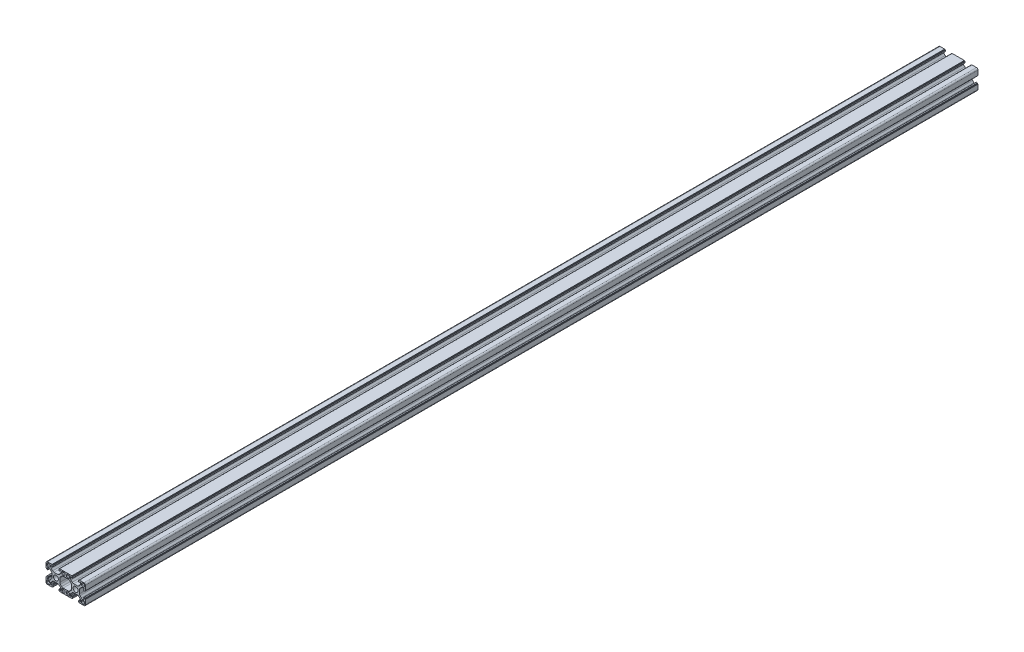
from build123d import *

# Parameters (mm, degrees)
EXTRUDE_1_DEPTH = 905


with BuildPart() as part:
    # Эскиз1 → Бобышка-Вытянуть1 (new body)
    with BuildSketch(Plane.XY):
        with BuildLine():
            Line((-0.885103948, 23.190978906), (1.013676721, 23.190978906))
            ThreePointArc((1.013676721, 23.190978906), (1.779043586, 23.343219841), (2.427890283, 23.776765343))
            Line((2.427890283, 23.776765343), (3.729109614, 25.077984674))
            ThreePointArc((3.729109614, 25.077984674), (4.162655117, 25.726831372), (4.314896052, 26.492198236))
            Line((4.314896052, 26.492198236), (4.314896052, 27.390978906))
            ThreePointArc((4.314896052, 27.390978906), (4.168449443, 27.744532296), (3.814896052, 27.890978906))
            Line((3.814896052, 27.890978906), (3.712002833, 27.890978906))
            ThreePointArc((3.712002833, 27.890978906), (3.520661117, 27.852918672), (3.358449443, 27.744532296))
            Line((3.358449443, 27.744532296), (2.878119357, 27.26420221))
            ThreePointArc((2.878119357, 27.26420221), (2.797013519, 27.210009022), (2.701342661, 27.190978906))
            Line((2.701342661, 27.190978906), (2.414896052, 27.190978906))
            ThreePointArc((2.414896052, 27.190978906), (2.238119357, 27.26420221), (2.164896052, 27.440978906))
            Line((2.164896052, 27.440978906), (2.164896052, 28.590049726))
            ThreePointArc((2.164896052, 28.590049726), (2.208830035, 28.696115743), (2.314896052, 28.740049726))
            Line((2.314896052, 28.740049726), (2.814896052, 28.740049726))
            Line((2.814896052, 28.740049726), (2.814896052, 29.040978906))
            ThreePointArc((2.814896052, 29.040978906), (2.858830035, 29.147044923), (2.964896052, 29.190978906))
            Line((2.964896052, 29.190978906), (7.614896052, 29.190978906))
            ThreePointArc((7.614896052, 29.190978906), (8.675556224, 28.751639077), (9.114896052, 27.690978906))
            Line((9.114896052, 27.690978906), (9.114896052, 23.040978906))
            ThreePointArc((9.114896052, 23.040978906), (9.070962069, 22.934912888), (8.964896052, 22.890978906))
            Line((8.964896052, 22.890978906), (8.663966872, 22.890978906))
            Line((8.663966872, 22.890978906), (8.663966872, 22.390978906))
            ThreePointArc((8.663966872, 22.390978906), (8.62003289, 22.284912888), (8.513966872, 22.240978906))
            Line((8.513966872, 22.240978906), (7.364896052, 22.240978906))
            ThreePointArc((7.364896052, 22.240978906), (7.188119357, 22.31420221), (7.114896052, 22.490978906))
            Line((7.114896052, 22.490978906), (7.114896052, 22.777425515))
            ThreePointArc((7.114896052, 22.777425515), (7.133926169, 22.873096373), (7.188119357, 22.95420221))
            Line((7.188119357, 22.95420221), (7.668449443, 23.434532296))
            ThreePointArc((7.668449443, 23.434532296), (7.776835818, 23.596743971), (7.814896052, 23.788085687))
            Line((7.814896052, 23.788085687), (7.814896052, 23.890978906))
            ThreePointArc((7.814896052, 23.890978906), (7.668449443, 24.244532296), (7.314896052, 24.390978906))
            Line((7.314896052, 24.390978906), (6.416115383, 24.390978906))
            ThreePointArc((6.416115383, 24.390978906), (5.650748518, 24.238737971), (5.001901821, 23.805192468))
            Line((5.001901821, 23.805192468), (3.70068249, 22.503973137))
            ThreePointArc((3.70068249, 22.503973137), (3.267136987, 21.855126439), (3.114896052, 21.089759575))
            Line((3.114896052, 21.089759575), (3.114896052, 19.190978906))
            Line((3.114896052, 19.190978906), (3.114896052, 17.292198236))
            ThreePointArc((3.114896052, 17.292198236), (3.267136987, 16.526831372), (3.70068249, 15.877984674))
            Line((3.70068249, 15.877984674), (5.001901821, 14.576765343))
            ThreePointArc((5.001901821, 14.576765343), (5.650748518, 14.143219841), (6.416115383, 13.990978906))
            Line((6.416115383, 13.990978906), (7.314896052, 13.990978906))
            ThreePointArc((7.314896052, 13.990978906), (7.668449443, 14.137425515), (7.814896052, 14.490978906))
            Line((7.814896052, 14.490978906), (7.814896052, 14.593872124))
            ThreePointArc((7.814896052, 14.593872124), (7.776835818, 14.785213841), (7.668449443, 14.947425515))
            Line((7.668449443, 14.947425515), (7.188119357, 15.427755601))
            ThreePointArc((7.188119357, 15.427755601), (7.133926169, 15.508861438), (7.114896052, 15.604532296))
            Line((7.114896052, 15.604532296), (7.114896052, 15.890978906))
            ThreePointArc((7.114896052, 15.890978906), (7.188119357, 16.067755601), (7.364896052, 16.140978906))
            Line((7.364896052, 16.140978906), (8.513966872, 16.140978906))
            ThreePointArc((8.513966872, 16.140978906), (8.62003289, 16.097044923), (8.663966872, 15.990978906))
            Line((8.663966872, 15.990978906), (8.663966872, 15.490978906))
            Line((8.663966872, 15.490978906), (8.964896052, 15.490978906))
            ThreePointArc((8.964896052, 15.490978906), (9.070962069, 15.447044923), (9.114896052, 15.340978906))
            Line((9.114896052, 15.340978906), (9.114896052, 10.690978906))
            ThreePointArc((9.114896052, 10.690978906), (8.675556224, 9.630318734), (7.614896052, 9.190978906))
            Line((7.614896052, 9.190978906), (2.964896052, 9.190978906))
            ThreePointArc((2.964896052, 9.190978906), (2.858830035, 9.234912888), (2.814896052, 9.340978906))
            Line((2.814896052, 9.340978906), (2.814896052, 9.641908085))
            Line((2.814896052, 9.641908085), (2.314896052, 9.641908085))
            ThreePointArc((2.314896052, 9.641908085), (2.208830035, 9.685842068), (2.164896052, 9.791908085))
            Line((2.164896052, 9.791908085), (2.164896052, 10.940978906))
            ThreePointArc((2.164896052, 10.940978906), (2.238119357, 11.117755601), (2.414896052, 11.190978906))
            Line((2.414896052, 11.190978906), (2.701342661, 11.190978906))
            ThreePointArc((2.701342661, 11.190978906), (2.797013519, 11.171948789), (2.878119357, 11.117755601))
            Line((2.878119357, 11.117755601), (3.358449443, 10.637425515))
            ThreePointArc((3.358449443, 10.637425515), (3.520661117, 10.529039139), (3.712002833, 10.490978906))
            Line((3.712002833, 10.490978906), (3.814896052, 10.490978906))
            ThreePointArc((3.814896052, 10.490978906), (4.168449443, 10.637425515), (4.314896052, 10.990978906))
            Line((4.314896052, 10.990978906), (4.314896052, 11.889759575))
            ThreePointArc((4.314896052, 11.889759575), (4.162655117, 12.655126439), (3.729109614, 13.303973137))
            Line((3.729109614, 13.303973137), (2.427890283, 14.605192468))
            ThreePointArc((2.427890283, 14.605192468), (1.779043586, 15.038737971), (1.013676721, 15.190978906))
            Line((1.013676721, 15.190978906), (-0.885103948, 15.190978906))
            Line((-0.885103948, 15.190978906), (-2.783884617, 15.190978906))
            ThreePointArc((-2.783884617, 15.190978906), (-3.549251482, 15.038737971), (-4.198098179, 14.605192468))
            Line((-4.198098179, 14.605192468), (-5.49931751, 13.303973137))
            ThreePointArc((-5.49931751, 13.303973137), (-5.932863013, 12.655126439), (-6.085103948, 11.889759575))
            Line((-6.085103948, 11.889759575), (-6.085103948, 10.990978906))
            ThreePointArc((-6.085103948, 10.990978906), (-5.938657339, 10.637425515), (-5.585103948, 10.490978906))
            Line((-5.585103948, 10.490978906), (-5.482210729, 10.490978906))
            ThreePointArc((-5.482210729, 10.490978906), (-5.290869013, 10.529039139), (-5.128657339, 10.637425515))
            Line((-5.128657339, 10.637425515), (-4.648327253, 11.117755601))
            ThreePointArc((-4.648327253, 11.117755601), (-4.567221416, 11.171948789), (-4.471550557, 11.190978906))
            Line((-4.471550557, 11.190978906), (-4.185103948, 11.190978906))
            ThreePointArc((-4.185103948, 11.190978906), (-4.008327253, 11.117755601), (-3.935103948, 10.940978906))
            Line((-3.935103948, 10.940978906), (-3.935103948, 9.791908085))
            ThreePointArc((-3.935103948, 9.791908085), (-3.979037931, 9.685842068), (-4.085103948, 9.641908085))
            Line((-4.085103948, 9.641908085), (-4.585103948, 9.641908085))
            Line((-4.585103948, 9.641908085), (-4.585103948, 9.340978906))
            ThreePointArc((-4.585103948, 9.340978906), (-4.629037931, 9.234912888), (-4.735103948, 9.190978906))
            Line((-4.735103948, 9.190978906), (-9.385103948, 9.190978906))
            Line((-9.385103948, 9.190978906), (-12.385103948, 9.190978906))
            Line((-12.385103948, 9.190978906), (-17.035103948, 9.190978906))
            ThreePointArc((-17.035103948, 9.190978906), (-17.141169965, 9.234912888), (-17.185103948, 9.340978906))
            Line((-17.185103948, 9.340978906), (-17.185103948, 9.641908085))
            Line((-17.185103948, 9.641908085), (-17.685103948, 9.641908085))
            ThreePointArc((-17.685103948, 9.641908085), (-17.791169965, 9.685842068), (-17.835103948, 9.791908085))
            Line((-17.835103948, 9.791908085), (-17.835103948, 10.940978906))
            ThreePointArc((-17.835103948, 10.940978906), (-17.761880643, 11.117755601), (-17.585103948, 11.190978906))
            Line((-17.585103948, 11.190978906), (-17.298657339, 11.190978906))
            ThreePointArc((-17.298657339, 11.190978906), (-17.202986481, 11.171948789), (-17.121880643, 11.117755601))
            Line((-17.121880643, 11.117755601), (-16.641550557, 10.637425515))
            ThreePointArc((-16.641550557, 10.637425515), (-16.479338883, 10.529039139), (-16.287997167, 10.490978906))
            Line((-16.287997167, 10.490978906), (-16.185103948, 10.490978906))
            ThreePointArc((-16.185103948, 10.490978906), (-15.831550557, 10.637425515), (-15.685103948, 10.990978906))
            Line((-15.685103948, 10.990978906), (-15.685103948, 11.889759575))
            ThreePointArc((-15.685103948, 11.889759575), (-15.837344883, 12.655126439), (-16.270890386, 13.303973137))
            Line((-16.270890386, 13.303973137), (-17.572109717, 14.605192468))
            ThreePointArc((-17.572109717, 14.605192468), (-18.220956414, 15.038737971), (-18.986323279, 15.190978906))
            Line((-18.986323279, 15.190978906), (-20.885103948, 15.190978906))
            Line((-20.885103948, 15.190978906), (-22.783884617, 15.190978906))
            ThreePointArc((-22.783884617, 15.190978906), (-23.549251482, 15.038737971), (-24.198098179, 14.605192468))
            Line((-24.198098179, 14.605192468), (-25.49931751, 13.303973137))
            ThreePointArc((-25.49931751, 13.303973137), (-25.932863013, 12.655126439), (-26.085103948, 11.889759575))
            Line((-26.085103948, 11.889759575), (-26.085103948, 10.990978906))
            ThreePointArc((-26.085103948, 10.990978906), (-25.938657339, 10.637425515), (-25.585103948, 10.490978906))
            Line((-25.585103948, 10.490978906), (-25.482210729, 10.490978906))
            ThreePointArc((-25.482210729, 10.490978906), (-25.290869013, 10.529039139), (-25.128657339, 10.637425515))
            Line((-25.128657339, 10.637425515), (-24.648327253, 11.117755601))
            ThreePointArc((-24.648327253, 11.117755601), (-24.567221416, 11.171948789), (-24.471550557, 11.190978906))
            Line((-24.471550557, 11.190978906), (-24.185103948, 11.190978906))
            ThreePointArc((-24.185103948, 11.190978906), (-24.008327253, 11.117755601), (-23.935103948, 10.940978906))
            Line((-23.935103948, 10.940978906), (-23.935103948, 9.791908085))
            ThreePointArc((-23.935103948, 9.791908085), (-23.979037931, 9.685842068), (-24.085103948, 9.641908085))
            Line((-24.085103948, 9.641908085), (-24.585103948, 9.641908085))
            Line((-24.585103948, 9.641908085), (-24.585103948, 9.340978906))
            ThreePointArc((-24.585103948, 9.340978906), (-24.629037931, 9.234912888), (-24.735103948, 9.190978906))
            Line((-24.735103948, 9.190978906), (-29.385103948, 9.190978906))
            ThreePointArc((-29.385103948, 9.190978906), (-30.44576412, 9.630318734), (-30.885103948, 10.690978906))
            Line((-30.885103948, 10.690978906), (-30.885103948, 15.340978906))
            ThreePointArc((-30.885103948, 15.340978906), (-30.841169965, 15.447044923), (-30.735103948, 15.490978906))
            Line((-30.735103948, 15.490978906), (-30.434174769, 15.490978906))
            Line((-30.434174769, 15.490978906), (-30.434174769, 15.990978906))
            ThreePointArc((-30.434174769, 15.990978906), (-30.390240786, 16.097044923), (-30.284174769, 16.140978906))
            Line((-30.284174769, 16.140978906), (-29.135103948, 16.140978906))
            ThreePointArc((-29.135103948, 16.140978906), (-28.958327253, 16.067755601), (-28.885103948, 15.890978906))
            Line((-28.885103948, 15.890978906), (-28.885103948, 15.604532296))
            ThreePointArc((-28.885103948, 15.604532296), (-28.904134065, 15.508861438), (-28.958327253, 15.427755601))
            Line((-28.958327253, 15.427755601), (-29.438657339, 14.947425515))
            ThreePointArc((-29.438657339, 14.947425515), (-29.547043714, 14.785213841), (-29.585103948, 14.593872124))
            Line((-29.585103948, 14.593872124), (-29.585103948, 14.490978906))
            ThreePointArc((-29.585103948, 14.490978906), (-29.438657339, 14.137425515), (-29.085103948, 13.990978906))
            Line((-29.085103948, 13.990978906), (-28.186323279, 13.990978906))
            ThreePointArc((-28.186323279, 13.990978906), (-27.420956414, 14.143219841), (-26.772109717, 14.576765343))
            Line((-26.772109717, 14.576765343), (-25.470890386, 15.877984674))
            ThreePointArc((-25.470890386, 15.877984674), (-25.037344883, 16.526831372), (-24.885103948, 17.292198236))
            Line((-24.885103948, 17.292198236), (-24.885103948, 19.190978906))
            Line((-24.885103948, 19.190978906), (-24.885103948, 21.089759575))
            ThreePointArc((-24.885103948, 21.089759575), (-25.037344883, 21.855126439), (-25.470890386, 22.503973137))
            Line((-25.470890386, 22.503973137), (-26.772109717, 23.805192468))
            ThreePointArc((-26.772109717, 23.805192468), (-27.420956414, 24.238737971), (-28.186323279, 24.390978906))
            Line((-28.186323279, 24.390978906), (-29.085103948, 24.390978906))
            ThreePointArc((-29.085103948, 24.390978906), (-29.438657339, 24.244532296), (-29.585103948, 23.890978906))
            Line((-29.585103948, 23.890978906), (-29.585103948, 23.788085687))
            ThreePointArc((-29.585103948, 23.788085687), (-29.547043714, 23.596743971), (-29.438657339, 23.434532296))
            Line((-29.438657339, 23.434532296), (-28.958327253, 22.95420221))
            ThreePointArc((-28.958327253, 22.95420221), (-28.904134065, 22.873096373), (-28.885103948, 22.777425515))
            Line((-28.885103948, 22.777425515), (-28.885103948, 22.490978906))
            ThreePointArc((-28.885103948, 22.490978906), (-28.958327253, 22.31420221), (-29.135103948, 22.240978906))
            Line((-29.135103948, 22.240978906), (-30.284174769, 22.240978906))
            ThreePointArc((-30.284174769, 22.240978906), (-30.390240786, 22.284912888), (-30.434174769, 22.390978906))
            Line((-30.434174769, 22.390978906), (-30.434174769, 22.890978906))
            Line((-30.434174769, 22.890978906), (-30.735103948, 22.890978906))
            ThreePointArc((-30.735103948, 22.890978906), (-30.841169965, 22.934912888), (-30.885103948, 23.040978906))
            Line((-30.885103948, 23.040978906), (-30.885103948, 27.690978906))
            ThreePointArc((-30.885103948, 27.690978906), (-30.44576412, 28.751639077), (-29.385103948, 29.190978906))
            Line((-29.385103948, 29.190978906), (-24.735103948, 29.190978906))
            ThreePointArc((-24.735103948, 29.190978906), (-24.629037931, 29.147044923), (-24.585103948, 29.040978906))
            Line((-24.585103948, 29.040978906), (-24.585103948, 28.740049726))
            Line((-24.585103948, 28.740049726), (-24.085103948, 28.740049726))
            ThreePointArc((-24.085103948, 28.740049726), (-23.979037931, 28.696115743), (-23.935103948, 28.590049726))
            Line((-23.935103948, 28.590049726), (-23.935103948, 27.440978906))
            ThreePointArc((-23.935103948, 27.440978906), (-24.008327253, 27.26420221), (-24.185103948, 27.190978906))
            Line((-24.185103948, 27.190978906), (-24.471550557, 27.190978906))
            ThreePointArc((-24.471550557, 27.190978906), (-24.567221416, 27.210009022), (-24.648327253, 27.26420221))
            Line((-24.648327253, 27.26420221), (-25.128657339, 27.744532296))
            ThreePointArc((-25.128657339, 27.744532296), (-25.290869013, 27.852918672), (-25.482210729, 27.890978906))
            Line((-25.482210729, 27.890978906), (-25.585103948, 27.890978906))
            ThreePointArc((-25.585103948, 27.890978906), (-25.938657339, 27.744532296), (-26.085103948, 27.390978906))
            Line((-26.085103948, 27.390978906), (-26.085103948, 26.492198236))
            ThreePointArc((-26.085103948, 26.492198236), (-25.932863013, 25.726831372), (-25.49931751, 25.077984674))
            Line((-25.49931751, 25.077984674), (-24.198098179, 23.776765343))
            ThreePointArc((-24.198098179, 23.776765343), (-23.549251482, 23.343219841), (-22.783884617, 23.190978906))
            Line((-22.783884617, 23.190978906), (-20.885103948, 23.190978906))
            Line((-20.885103948, 23.190978906), (-18.986323279, 23.190978906))
            ThreePointArc((-18.986323279, 23.190978906), (-18.220956414, 23.343219841), (-17.572109717, 23.776765343))
            Line((-17.572109717, 23.776765343), (-16.270890386, 25.077984674))
            ThreePointArc((-16.270890386, 25.077984674), (-15.837344883, 25.726831372), (-15.685103948, 26.492198236))
            Line((-15.685103948, 26.492198236), (-15.685103948, 27.390978906))
            ThreePointArc((-15.685103948, 27.390978906), (-15.831550557, 27.744532296), (-16.185103948, 27.890978906))
            Line((-16.185103948, 27.890978906), (-16.287997167, 27.890978906))
            ThreePointArc((-16.287997167, 27.890978906), (-16.479338883, 27.852918672), (-16.641550557, 27.744532296))
            Line((-16.641550557, 27.744532296), (-17.121880643, 27.26420221))
            ThreePointArc((-17.121880643, 27.26420221), (-17.202986481, 27.210009022), (-17.298657339, 27.190978906))
            Line((-17.298657339, 27.190978906), (-17.585103948, 27.190978906))
            ThreePointArc((-17.585103948, 27.190978906), (-17.761880643, 27.26420221), (-17.835103948, 27.440978906))
            Line((-17.835103948, 27.440978906), (-17.835103948, 28.590049726))
            ThreePointArc((-17.835103948, 28.590049726), (-17.791169965, 28.696115743), (-17.685103948, 28.740049726))
            Line((-17.685103948, 28.740049726), (-17.185103948, 28.740049726))
            Line((-17.185103948, 28.740049726), (-17.185103948, 29.040978906))
            ThreePointArc((-17.185103948, 29.040978906), (-17.141169965, 29.147044923), (-17.035103948, 29.190978906))
            Line((-17.035103948, 29.190978906), (-12.385103948, 29.190978906))
            Line((-12.385103948, 29.190978906), (-9.385103948, 29.190978906))
            Line((-9.385103948, 29.190978906), (-4.735103948, 29.190978906))
            ThreePointArc((-4.735103948, 29.190978906), (-4.629037931, 29.147044923), (-4.585103948, 29.040978906))
            Line((-4.585103948, 29.040978906), (-4.585103948, 28.740049726))
            Line((-4.585103948, 28.740049726), (-4.085103948, 28.740049726))
            ThreePointArc((-4.085103948, 28.740049726), (-3.979037931, 28.696115743), (-3.935103948, 28.590049726))
            Line((-3.935103948, 28.590049726), (-3.935103948, 27.440978906))
            ThreePointArc((-3.935103948, 27.440978906), (-4.008327253, 27.26420221), (-4.185103948, 27.190978906))
            Line((-4.185103948, 27.190978906), (-4.471550557, 27.190978906))
            ThreePointArc((-4.471550557, 27.190978906), (-4.567221416, 27.210009022), (-4.648327253, 27.26420221))
            Line((-4.648327253, 27.26420221), (-5.128657339, 27.744532296))
            ThreePointArc((-5.128657339, 27.744532296), (-5.290869013, 27.852918672), (-5.482210729, 27.890978906))
            Line((-5.482210729, 27.890978906), (-5.585103948, 27.890978906))
            ThreePointArc((-5.585103948, 27.890978906), (-5.938657339, 27.744532296), (-6.085103948, 27.390978906))
            Line((-6.085103948, 27.390978906), (-6.085103948, 26.492198236))
            ThreePointArc((-6.085103948, 26.492198236), (-5.932863013, 25.726831372), (-5.49931751, 25.077984674))
            Line((-5.49931751, 25.077984674), (-4.198098179, 23.776765343))
            ThreePointArc((-4.198098179, 23.776765343), (-3.549251482, 23.343219841), (-2.783884617, 23.190978906))
            Line((-2.783884617, 23.190978906), (-0.885103948, 23.190978906))
        make_face()
        with BuildLine():
            Line((6.014896052, 25.290978906), (7.414896052, 25.290978906))
            ThreePointArc((7.414896052, 25.290978906), (7.980581477, 25.525293481), (8.214896052, 26.090978906))
            Line((8.214896052, 26.090978906), (8.214896052, 27.490978906))
            ThreePointArc((8.214896052, 27.490978906), (7.980581477, 28.05666433), (7.414896052, 28.290978906))
            Line((7.414896052, 28.290978906), (6.014896052, 28.290978906))
            ThreePointArc((6.014896052, 28.290978906), (5.449210627, 28.05666433), (5.214896052, 27.490978906))
            Line((5.214896052, 27.490978906), (5.214896052, 26.090978906))
            ThreePointArc((5.214896052, 26.090978906), (5.449210627, 25.525293481), (6.014896052, 25.290978906))
        make_face(mode=Mode.SUBTRACT)
        with BuildLine():
            Line((5.214896052, 12.290978906), (5.214896052, 10.890978906))
            ThreePointArc((5.214896052, 10.890978906), (5.449210627, 10.325293481), (6.014896052, 10.090978906))
            Line((6.014896052, 10.090978906), (7.414896052, 10.090978906))
            ThreePointArc((7.414896052, 10.090978906), (7.980581477, 10.325293481), (8.214896052, 10.890978906))
            Line((8.214896052, 10.890978906), (8.214896052, 12.290978906))
            ThreePointArc((8.214896052, 12.290978906), (7.980581477, 12.85666433), (7.414896052, 13.090978906))
            Line((7.414896052, 13.090978906), (6.014896052, 13.090978906))
            ThreePointArc((6.014896052, 13.090978906), (5.449210627, 12.85666433), (5.214896052, 12.290978906))
        make_face(mode=Mode.SUBTRACT)
        with BuildLine():
            Line((-7.785103948, 13.090978906), (-9.185103948, 13.090978906))
            ThreePointArc((-9.185103948, 13.090978906), (-9.750789373, 12.85666433), (-9.985103948, 12.290978906))
            Line((-9.985103948, 12.290978906), (-9.985103948, 10.890978906))
            ThreePointArc((-9.985103948, 10.890978906), (-9.750789373, 10.325293481), (-9.185103948, 10.090978906))
            Line((-9.185103948, 10.090978906), (-7.785103948, 10.090978906))
            ThreePointArc((-7.785103948, 10.090978906), (-7.219418523, 10.325293481), (-6.985103948, 10.890978906))
            Line((-6.985103948, 10.890978906), (-6.985103948, 12.290978906))
            ThreePointArc((-6.985103948, 12.290978906), (-7.219418523, 12.85666433), (-7.785103948, 13.090978906))
        make_face(mode=Mode.SUBTRACT)
        with BuildLine():
            Line((-9.085103948, 13.990978906), (-8.186323279, 13.990978906))
            ThreePointArc((-8.186323279, 13.990978906), (-7.420956414, 14.143219841), (-6.772109717, 14.576765343))
            Line((-6.772109717, 14.576765343), (-5.470890386, 15.877984674))
            ThreePointArc((-5.470890386, 15.877984674), (-5.037344883, 16.526831372), (-4.885103948, 17.292198236))
            Line((-4.885103948, 17.292198236), (-4.885103948, 19.190978906))
            Line((-4.885103948, 19.190978906), (-4.885103948, 21.089759575))
            ThreePointArc((-4.885103948, 21.089759575), (-5.037344883, 21.855126439), (-5.470890386, 22.503973137))
            Line((-5.470890386, 22.503973137), (-6.772109717, 23.805192468))
            ThreePointArc((-6.772109717, 23.805192468), (-7.420956414, 24.238737971), (-8.186323279, 24.390978906))
            Line((-8.186323279, 24.390978906), (-9.085103948, 24.390978906))
            Line((-9.085103948, 24.390978906), (-12.685103948, 24.390978906))
            Line((-12.685103948, 24.390978906), (-13.583884617, 24.390978906))
            ThreePointArc((-13.583884617, 24.390978906), (-14.349251482, 24.238737971), (-14.998098179, 23.805192468))
            Line((-14.998098179, 23.805192468), (-16.29931751, 22.503973137))
            ThreePointArc((-16.29931751, 22.503973137), (-16.732863013, 21.855126439), (-16.885103948, 21.089759575))
            Line((-16.885103948, 21.089759575), (-16.885103948, 19.190978906))
            Line((-16.885103948, 19.190978906), (-16.885103948, 17.292198236))
            ThreePointArc((-16.885103948, 17.292198236), (-16.732863013, 16.526831372), (-16.29931751, 15.877984674))
            Line((-16.29931751, 15.877984674), (-14.998098179, 14.576765343))
            ThreePointArc((-14.998098179, 14.576765343), (-14.349251482, 14.143219841), (-13.583884617, 13.990978906))
            Line((-13.583884617, 13.990978906), (-12.685103948, 13.990978906))
            Line((-12.685103948, 13.990978906), (-9.085103948, 13.990978906))
        make_face(mode=Mode.SUBTRACT)
        with BuildLine():
            Line((-6.985103948, 26.090978906), (-6.985103948, 27.490978906))
            ThreePointArc((-6.985103948, 27.490978906), (-7.219418523, 28.05666433), (-7.785103948, 28.290978906))
            Line((-7.785103948, 28.290978906), (-9.185103948, 28.290978906))
            ThreePointArc((-9.185103948, 28.290978906), (-9.750789373, 28.05666433), (-9.985103948, 27.490978906))
            Line((-9.985103948, 27.490978906), (-9.985103948, 26.090978906))
            ThreePointArc((-9.985103948, 26.090978906), (-9.750789373, 25.525293481), (-9.185103948, 25.290978906))
            Line((-9.185103948, 25.290978906), (-7.785103948, 25.290978906))
            ThreePointArc((-7.785103948, 25.290978906), (-7.219418523, 25.525293481), (-6.985103948, 26.090978906))
        make_face(mode=Mode.SUBTRACT)
        with BuildLine():
            Line((-12.585103948, 28.290978906), (-13.985103948, 28.290978906))
            ThreePointArc((-13.985103948, 28.290978906), (-14.550789373, 28.05666433), (-14.785103948, 27.490978906))
            Line((-14.785103948, 27.490978906), (-14.785103948, 26.090978906))
            ThreePointArc((-14.785103948, 26.090978906), (-14.550789373, 25.525293481), (-13.985103948, 25.290978906))
            Line((-13.985103948, 25.290978906), (-12.585103948, 25.290978906))
            ThreePointArc((-12.585103948, 25.290978906), (-12.019418523, 25.525293481), (-11.785103948, 26.090978906))
            Line((-11.785103948, 26.090978906), (-11.785103948, 27.490978906))
            ThreePointArc((-11.785103948, 27.490978906), (-12.019418523, 28.05666433), (-12.585103948, 28.290978906))
        make_face(mode=Mode.SUBTRACT)
        with BuildLine():
            Line((-11.785103948, 10.890978906), (-11.785103948, 12.290978906))
            ThreePointArc((-11.785103948, 12.290978906), (-12.019418523, 12.85666433), (-12.585103948, 13.090978906))
            Line((-12.585103948, 13.090978906), (-13.985103948, 13.090978906))
            ThreePointArc((-13.985103948, 13.090978906), (-14.550789373, 12.85666433), (-14.785103948, 12.290978906))
            Line((-14.785103948, 12.290978906), (-14.785103948, 10.890978906))
            ThreePointArc((-14.785103948, 10.890978906), (-14.550789373, 10.325293481), (-13.985103948, 10.090978906))
            Line((-13.985103948, 10.090978906), (-12.585103948, 10.090978906))
            ThreePointArc((-12.585103948, 10.090978906), (-12.019418523, 10.325293481), (-11.785103948, 10.890978906))
        make_face(mode=Mode.SUBTRACT)
        with BuildLine():
            Line((-29.185103948, 10.090978906), (-27.785103948, 10.090978906))
            ThreePointArc((-27.785103948, 10.090978906), (-27.219418523, 10.325293481), (-26.985103948, 10.890978906))
            Line((-26.985103948, 10.890978906), (-26.985103948, 12.290978906))
            ThreePointArc((-26.985103948, 12.290978906), (-27.219418523, 12.85666433), (-27.785103948, 13.090978906))
            Line((-27.785103948, 13.090978906), (-29.185103948, 13.090978906))
            ThreePointArc((-29.185103948, 13.090978906), (-29.750789373, 12.85666433), (-29.985103948, 12.290978906))
            Line((-29.985103948, 12.290978906), (-29.985103948, 10.890978906))
            ThreePointArc((-29.985103948, 10.890978906), (-29.750789373, 10.325293481), (-29.185103948, 10.090978906))
        make_face(mode=Mode.SUBTRACT)
        with BuildLine():
            Line((-29.985103948, 27.490978906), (-29.985103948, 26.090978906))
            ThreePointArc((-29.985103948, 26.090978906), (-29.750789373, 25.525293481), (-29.185103948, 25.290978906))
            Line((-29.185103948, 25.290978906), (-27.785103948, 25.290978906))
            ThreePointArc((-27.785103948, 25.290978906), (-27.219418523, 25.525293481), (-26.985103948, 26.090978906))
            Line((-26.985103948, 26.090978906), (-26.985103948, 27.490978906))
            ThreePointArc((-26.985103948, 27.490978906), (-27.219418523, 28.05666433), (-27.785103948, 28.290978906))
            Line((-27.785103948, 28.290978906), (-29.185103948, 28.290978906))
            ThreePointArc((-29.185103948, 28.290978906), (-29.750789373, 28.05666433), (-29.985103948, 27.490978906))
        make_face(mode=Mode.SUBTRACT)
        with BuildLine():
            ThreePointArc((1.614896052, 19.190978906), (0.882663005, 20.958745858), (-0.885103948, 21.690978906))
            ThreePointArc((-0.885103948, 21.690978906), (-2.652870901, 20.958745858), (-3.385103948, 19.190978906))
            ThreePointArc((-3.385103948, 19.190978906), (-2.652870901, 17.423211953), (-0.885103948, 16.690978906))
            ThreePointArc((-0.885103948, 16.690978906), (0.882663005, 17.423211953), (1.614896052, 19.190978906))
        make_face(mode=Mode.SUBTRACT)
        with BuildLine():
            ThreePointArc((-20.885103948, 21.690978906), (-19.117336995, 20.958745858), (-18.385103948, 19.190978906))
            ThreePointArc((-18.385103948, 19.190978906), (-19.117336995, 17.423211953), (-20.885103948, 16.690978906))
            ThreePointArc((-20.885103948, 16.690978906), (-22.652870901, 17.423211953), (-23.385103948, 19.190978906))
            ThreePointArc((-23.385103948, 19.190978906), (-22.652870901, 20.958745858), (-20.885103948, 21.690978906))
        make_face(mode=Mode.SUBTRACT)
    extrude(amount=EXTRUDE_1_DEPTH)


solid = part.part
